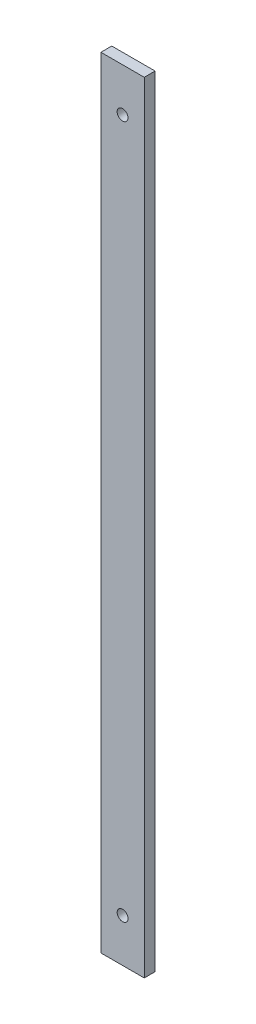
from build123d import *

# Parameters (mm, degrees)
SKETCH1_W           = 101.6
SKETCH1_H           = 1828.8
BOSS_EXTRUDE1_DEPTH = 25.4
SKETCH2_R           = 12.7
CUT_EXTRUDE1_DEPTH  = 1830.681731887


with BuildPart() as part:
    # Sketch1 → Boss-Extrude1 (new body)
    with BuildSketch(Plane.XY):
        with Locations((0, 914.4)):
            Rectangle(SKETCH1_W, SKETCH1_H)
    extrude(amount=BOSS_EXTRUDE1_DEPTH)

    # Sketch2 → Cut-Extrude1 (cut, through all)
    with BuildSketch(Plane.XY.offset(25.4)):
        with Locations((0, 1727.2)):
            Circle(SKETCH2_R)
        with Locations((0, 101.6)):
            Circle(SKETCH2_R)
    extrude(amount=-CUT_EXTRUDE1_DEPTH, mode=Mode.SUBTRACT)


solid = part.part
